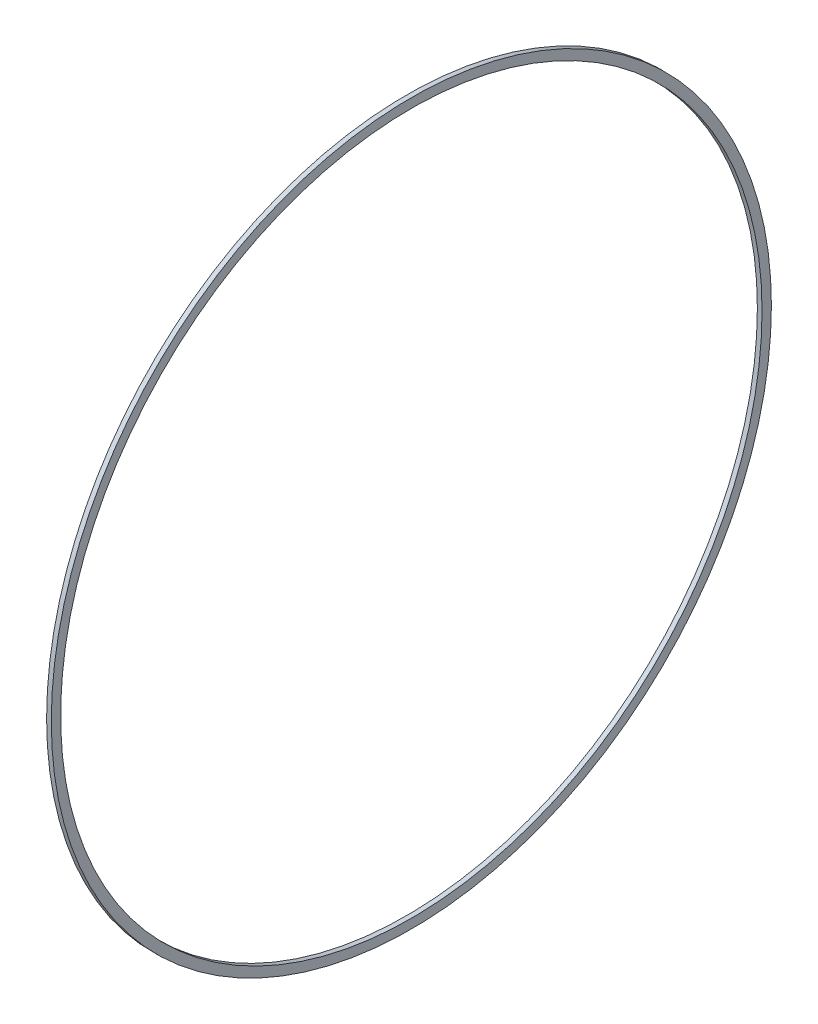
from build123d import *

# Parameters (mm, degrees)
SKETCH1_R           = 770
SKETCH1_R_2         = 750
BOSS_EXTRUDE1_DEPTH = 10


with BuildPart() as part:
    # Sketch1 → Boss-Extrude1 (new body)
    with BuildSketch(Plane(origin=(0, 0, 0), x_dir=(0, 0, -1), z_dir=(1, 0, 0))):
        Circle(SKETCH1_R)
        Circle(SKETCH1_R_2, mode=Mode.SUBTRACT)
    extrude(amount=BOSS_EXTRUDE1_DEPTH)


solid = part.part
